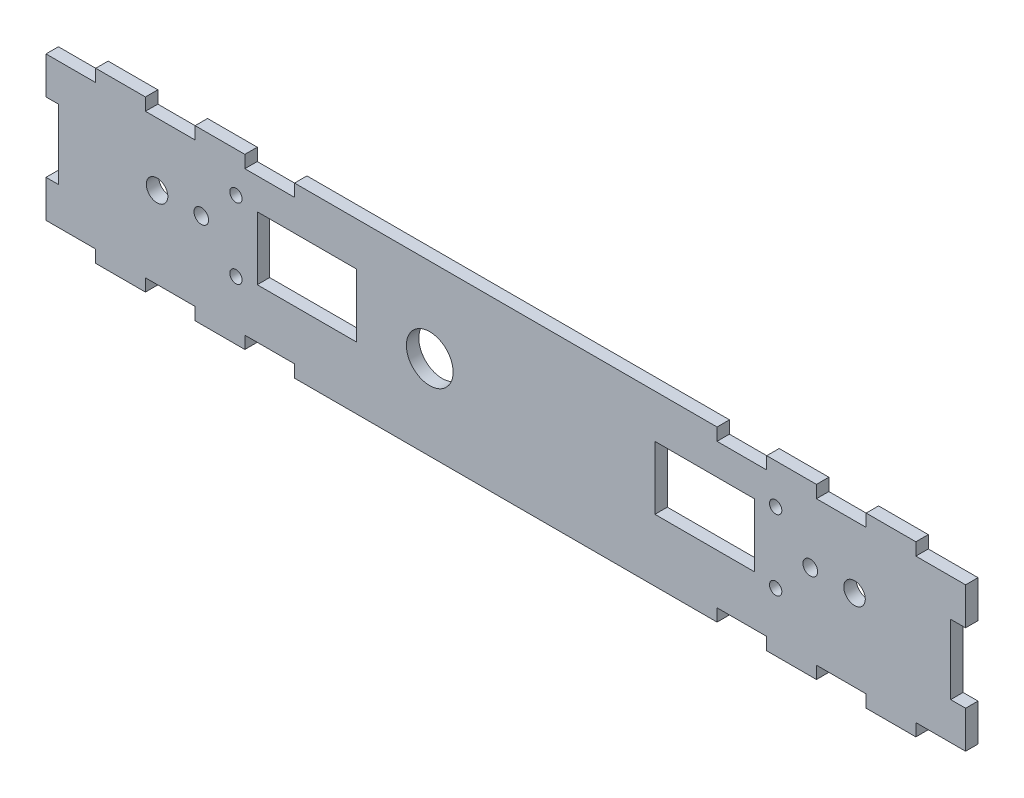
from build123d import *

# Parameters (mm, degrees)
SKETCH3_W           = 234.95
SKETCH3_H           = 30.48
SKETCH3_R           = 1.574999898
SKETCH3_W_2         = 25.4
SKETCH3_H_2         = 3.175
BOSS_EXTRUDE1_DEPTH = 3.175
SKETCH4_W           = 107.95
SKETCH4_H           = 3.175
SKETCH4_W_2         = 12.7
BOSS_EXTRUDE2_DEPTH = 3.175
SKETCH5_W           = 3.175
SKETCH5_H           = 17.78
SKETCH5_W_2         = 3.81
CUT_EXTRUDE1_DEPTH  = 7.62
SKETCH6_R           = 5.969
CUT_EXTRUDE2_DEPTH  = 5.08


with BuildPart() as part:
    # Sketch3 → Boss-Extrude1 (new body)
    # profile 1 of 7: a face of its own
    with BuildSketch(Plane.XY):
        with Locations((-63.5, 8.8475)):
            Rectangle(SKETCH3_W, SKETCH3_H)
        with BuildLine():
            ThreePointArc((-163.6, 17.5), (-162.135533906, 21.035533906), (-158.6, 22.5))
            Line((-158.6, 22.5), (-127, 22.5))
            Line((-127, 22.5), (-101.6, 22.5))
            Line((-101.6, 22.5), (-101.6, 19.325))
            Line((-101.6, 19.325), (-101.6, 3.175))
            Line((-101.6, 3.175), (-101.6, 0))
            Line((-101.6, 0), (-127, 0))
            Line((-127, 0), (-158.6, 0))
            ThreePointArc((-158.6, 0), (-162.135533906, 1.464466094), (-163.6, 5))
            Line((-163.6, 5), (-163.6, 17.5))
        make_face(mode=Mode.SUBTRACT)
        with BuildLine():
            Line((-25.4, 22.5), (0, 22.5))
            Line((0, 22.5), (31.6, 22.5))
            ThreePointArc((31.6, 22.5), (35.135533906, 21.035533906), (36.6, 17.5))
            Line((36.6, 17.5), (36.6, 5))
            ThreePointArc((36.6, 5), (35.135533906, 1.464466094), (31.6, 0))
            Line((31.6, 0), (0, 0))
            Line((0, 0), (-25.4, 0))
            Line((-25.4, 0), (-25.4, 3.175))
            Line((-25.4, 3.175), (-25.4, 19.325))
            Line((-25.4, 19.325), (-25.4, 22.5))
        make_face(mode=Mode.SUBTRACT)
    # profile 2 of 7: a face of its own
    with BuildSketch(Plane.XY):
        with BuildLine():
            ThreePointArc((-158.6, 0), (-162.135533906, 1.464466094), (-163.6, 5))
            Line((-163.6, 5), (-163.6, 17.5))
            ThreePointArc((-163.6, 17.5), (-162.135533906, 21.035533906), (-158.6, 22.5))
            Line((-158.6, 22.5), (-127, 22.5))
            Line((-127, 22.5), (-127, 0))
            Line((-127, 0), (-158.6, 0))
        make_face()
        with Locations((-132.45, 20.25)):
            Circle(SKETCH3_R, mode=Mode.SUBTRACT)
        with Locations((-132.45, 2.250000072)):
            Circle(SKETCH3_R, mode=Mode.SUBTRACT)
        with BuildLine():
            ThreePointArc((-143.175, 11.25), (-141.3, 13.125), (-139.425, 11.25))
            ThreePointArc((-139.425, 11.25), (-141.3, 9.375), (-143.175, 11.25))
        make_face(mode=Mode.SUBTRACT)
        with BuildLine():
            ThreePointArc((-155.35, 11.25), (-152.6, 14), (-149.85, 11.25))
            ThreePointArc((-149.85, 11.25), (-152.6, 8.5), (-155.35, 11.25))
        make_face(mode=Mode.SUBTRACT)
    # profile 3 of 7: a face of its own
    with BuildSketch(Plane.XY):
        with BuildLine():
            Line((36.6, 5), (36.6, 17.5))
            ThreePointArc((36.6, 17.5), (35.135533906, 21.035533906), (31.6, 22.5))
            Line((31.6, 22.5), (0, 22.5))
            Line((0, 22.5), (0, 0))
            Line((0, 0), (31.6, 0))
            ThreePointArc((31.6, 0), (35.135533906, 1.464466094), (36.6, 5))
        make_face()
        with Locations((5.45, 2.250000072)):
            Circle(SKETCH3_R, mode=Mode.SUBTRACT)
        with Locations((5.45, 20.25)):
            Circle(SKETCH3_R, mode=Mode.SUBTRACT)
        with BuildLine():
            ThreePointArc((16.175, 11.25), (14.3, 13.125), (12.425, 11.25))
            ThreePointArc((12.425, 11.25), (14.3, 9.375), (16.175, 11.25))
        make_face(mode=Mode.SUBTRACT)
        with BuildLine():
            ThreePointArc((28.35, 11.25), (25.6, 14), (22.85, 11.25))
            ThreePointArc((22.85, 11.25), (25.6, 8.5), (28.35, 11.25))
        make_face(mode=Mode.SUBTRACT)
    # profile 4 of 7: a face of its own
    with BuildSketch(Plane.XY):
        with Locations((-12.7, 1.5875)):
            Rectangle(SKETCH3_W_2, SKETCH3_H_2)
    # profile 5 of 7: a face of its own
    with BuildSketch(Plane.XY):
        with Locations((-12.7, 20.9125)):
            Rectangle(SKETCH3_W_2, SKETCH3_H_2)
    # profile 6 of 7: a face of its own
    with BuildSketch(Plane.XY):
        with Locations((-114.3, 20.9125)):
            Rectangle(SKETCH3_W_2, SKETCH3_H_2)
    # profile 7 of 7: a face of its own
    with BuildSketch(Plane.XY):
        with Locations((-114.3, 1.5875)):
            Rectangle(SKETCH3_W_2, SKETCH3_H_2)
    extrude(amount=BOSS_EXTRUDE1_DEPTH)

    # Sketch4 → Boss-Extrude2 (add)
    with BuildSketch(Plane.XY.offset(3.175)):
        with Locations((-63.5, 28.85)):
            Rectangle(SKETCH4_W, SKETCH4_H)
        with Locations((-136.525, 28.85)):
            Rectangle(SKETCH4_W_2, SKETCH4_H)
        with Locations((-161.925, 28.85)):
            Rectangle(SKETCH4_W_2, SKETCH4_H)
        Polygon((-142.875, 27.2625), (-155.575, 27.2625), (-168.275, 27.2625), (-180.975, 27.2625), (-180.975, 24.0875), (53.975, 24.0875), (53.975, 27.2625), (41.275, 27.2625), (28.575, 27.2625), (15.875, 27.2625), (3.175, 27.2625), (-9.525, 27.2625), (-117.475, 27.2625), (-130.175, 27.2625), align=None)
        with Locations((9.525, 28.85)):
            Rectangle(SKETCH4_W_2, SKETCH4_H)
        with Locations((34.925, 28.85)):
            Rectangle(SKETCH4_W_2, SKETCH4_H)
        Polygon((53.975, -6.3925), (-180.975, -6.3925), (-180.975, -9.5675), (-168.275, -9.5675), (-155.575, -9.5675), (-142.875, -9.5675), (-130.175, -9.5675), (-117.475, -9.5675), (-9.525, -9.5675), (3.175, -9.5675), (15.875, -9.5675), (28.575, -9.5675), (41.275, -9.5675), (53.975, -9.5675), align=None)
        with Locations((34.925, -11.155)):
            Rectangle(SKETCH4_W_2, SKETCH4_H)
        with Locations((9.525, -11.155)):
            Rectangle(SKETCH4_W_2, SKETCH4_H)
        with Locations((-63.5, -11.155)):
            Rectangle(SKETCH4_W, SKETCH4_H)
        with Locations((-136.525, -11.155)):
            Rectangle(SKETCH4_W_2, SKETCH4_H)
        with Locations((-161.925, -11.155)):
            Rectangle(SKETCH4_W_2, SKETCH4_H)
    extrude(amount=-BOSS_EXTRUDE2_DEPTH)

    # Sketch5 → Cut-Extrude1 (cut)
    with BuildSketch(Plane.XY.offset(3.175)):
        with Locations((-179.3875, 8.8475)):
            Rectangle(SKETCH5_W, SKETCH5_H)
        with Locations((52.07, 8.8475)):
            Rectangle(SKETCH5_W_2, SKETCH5_H)
    extrude(amount=-CUT_EXTRUDE1_DEPTH, mode=Mode.SUBTRACT)

    # Sketch6 → Cut-Extrude2 (cut)
    with BuildSketch(Plane(origin=(0, 0, 0), x_dir=(-1, 0, 0), z_dir=(0, 0, -1))):
        with Locations((82.931, 8.8475)):
            Circle(SKETCH6_R)
    extrude(amount=-CUT_EXTRUDE2_DEPTH, mode=Mode.SUBTRACT)


solid = part.part
